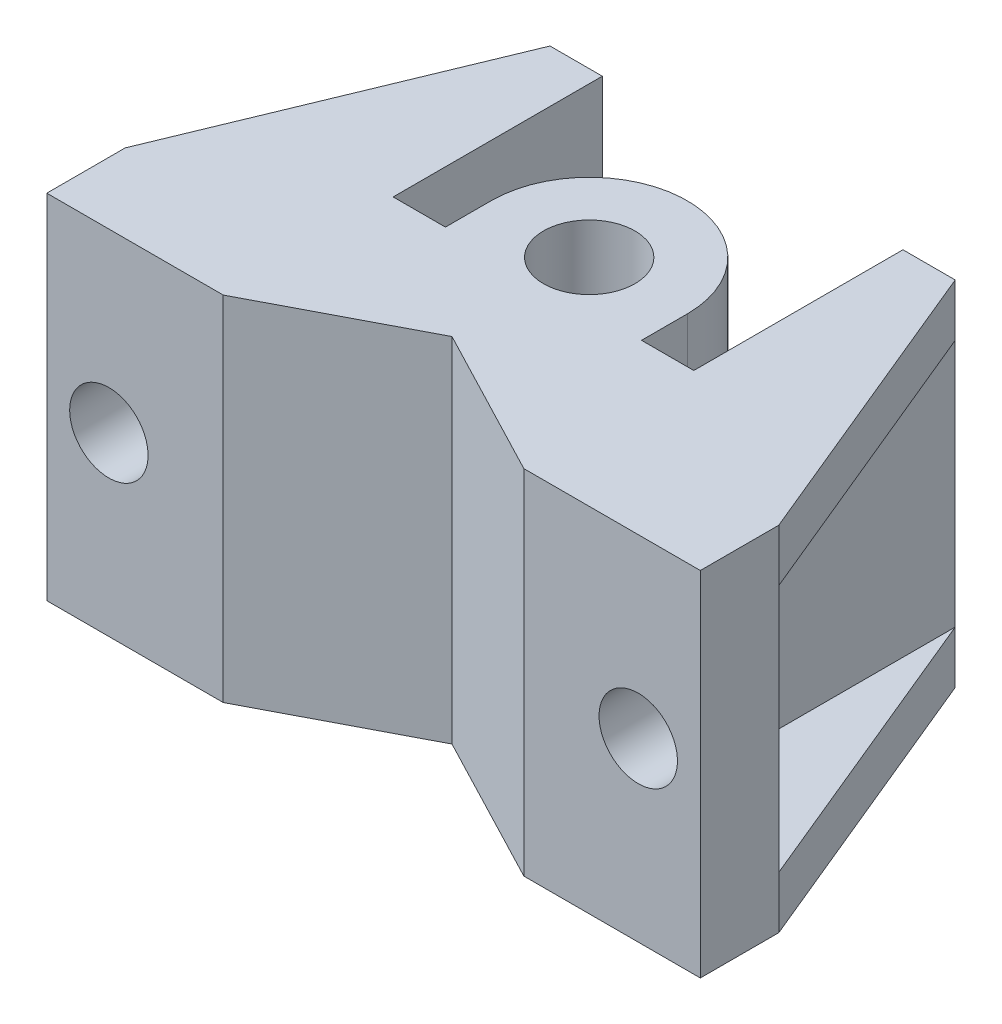
from build123d import *

# Parameters (mm, degrees)
SKETCH_1_R          = 7
EXTRUDE_1_DEPTH     = 27
SKETCH_2_W          = 19
SKETCH_2_H          = 38
SKETCH_2_R          = 6
CUT_EXTRUDE_1_DEPTH = 46
SKETCH_2_2_R        = 6
CUT_EXTRUDE_2_DEPTH = 82.197290595


with BuildPart() as part:
    # 草图1 → 凸台-拉伸1 (new, symmetric)
    with BuildSketch(Plane(origin=(0, 0, 0), x_dir=(1, 0, 0), z_dir=(0, 1, 0))):
        with BuildLine():
            Line((15, 0), (15, -7))
            Line((15, -7), (23, -7))
            Line((23, -7), (23, 25))
            Line((23, 25), (31, 25))
            Line((31, 25), (50, -21))
            Line((50, -21), (50, -33))
            Line((50, -33), (23, -33))
            Line((23, -33), (0, -21))
            Line((0, -21), (-23, -33))
            Line((-23, -33), (-50, -33))
            Line((-50, -33), (-50, -21))
            Line((-50, -21), (-31, 25))
            Line((-31, 25), (-23, 25))
            Line((-23, 25), (-23, -7))
            Line((-23, -7), (-15, -7))
            Line((-15, -7), (-15, 0))
            ThreePointArc((-15, 0), (0, 15), (15, 0))
        make_face()
        with Locations(Location((0, 0, 0), (0, 0, 270))):
            Circle(SKETCH_1_R, mode=Mode.SUBTRACT)
    extrude(amount=EXTRUDE_1_DEPTH, both=True)

    # 草图2 → 切除-拉伸1 (cut)
    # profile 1 of 2: a face of its own
    with BuildSketch(Plane(origin=(0, 0, -25), x_dir=(-1, 0, 0), z_dir=(0, 0, -1))):
        with Locations((40.5, 0)):
            Rectangle(SKETCH_2_W, SKETCH_2_H)
        with Locations((40.5, 0)):
            Circle(SKETCH_2_R, mode=Mode.SUBTRACT)
    # profile 2 of 2: a face of its own
    with BuildSketch(Plane(origin=(0, 0, -25), x_dir=(-1, 0, 0), z_dir=(0, 0, -1))):
        with Locations((-40.5, 0)):
            Rectangle(SKETCH_2_W, SKETCH_2_H)
        with Locations((-40.5, 0)):
            Circle(SKETCH_2_R, mode=Mode.SUBTRACT)
    extrude(amount=-CUT_EXTRUDE_1_DEPTH, mode=Mode.SUBTRACT)

    # 草图2<2> → 切除-拉伸2 (cut, through all)
    with BuildSketch(Plane(origin=(0, 0, -25), x_dir=(-1, 0, 0), z_dir=(0, 0, -1))):
        with Locations((40.5, 0)):
            Circle(SKETCH_2_2_R)
        with Locations((-40.5, 0)):
            Circle(SKETCH_2_2_R)
    extrude(amount=-CUT_EXTRUDE_2_DEPTH, mode=Mode.SUBTRACT)


solid = part.part
